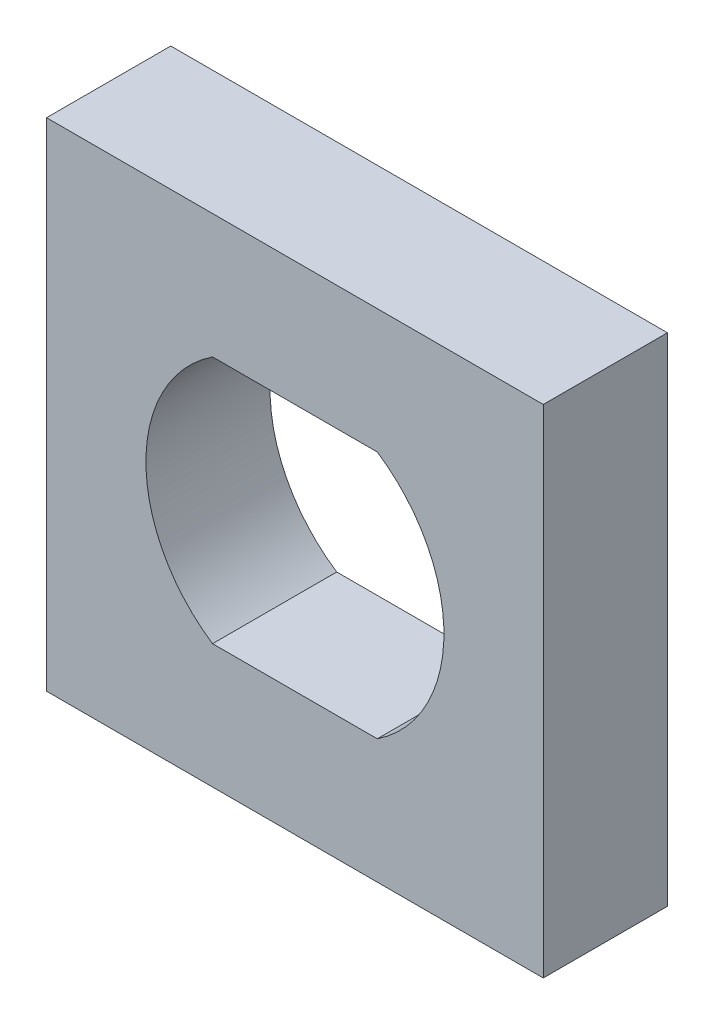
from build123d import *

# Parameters (mm, degrees)
SKETCH1_W           = 20
SKETCH1_H           = 20
SKETCH1_R           = 6
BOSS_EXTRUDE1_DEPTH = 5


with BuildPart() as part:
    # Sketch1 → Boss-Extrude1 (new body)
    # profile 1 of 3: a face of its own
    with BuildSketch(Plane.XY):
        Rectangle(SKETCH1_W, SKETCH1_H)
        Circle(SKETCH1_R, mode=Mode.SUBTRACT)
    # profile 2 of 3: a face of its own
    with BuildSketch(Plane.XY):
        with BuildLine():
            ThreePointArc((3.31662479, 5), (0, 6), (-3.31662479, 5))
            Line((-3.31662479, 5), (3.31662479, 5))
        make_face()
    # profile 3 of 3: a face of its own
    with BuildSketch(Plane.XY):
        with BuildLine():
            Line((3.31662479, -5), (-3.31662479, -5))
            ThreePointArc((-3.31662479, -5), (0, -6), (3.31662479, -5))
        make_face()
    extrude(amount=BOSS_EXTRUDE1_DEPTH)


solid = part.part
